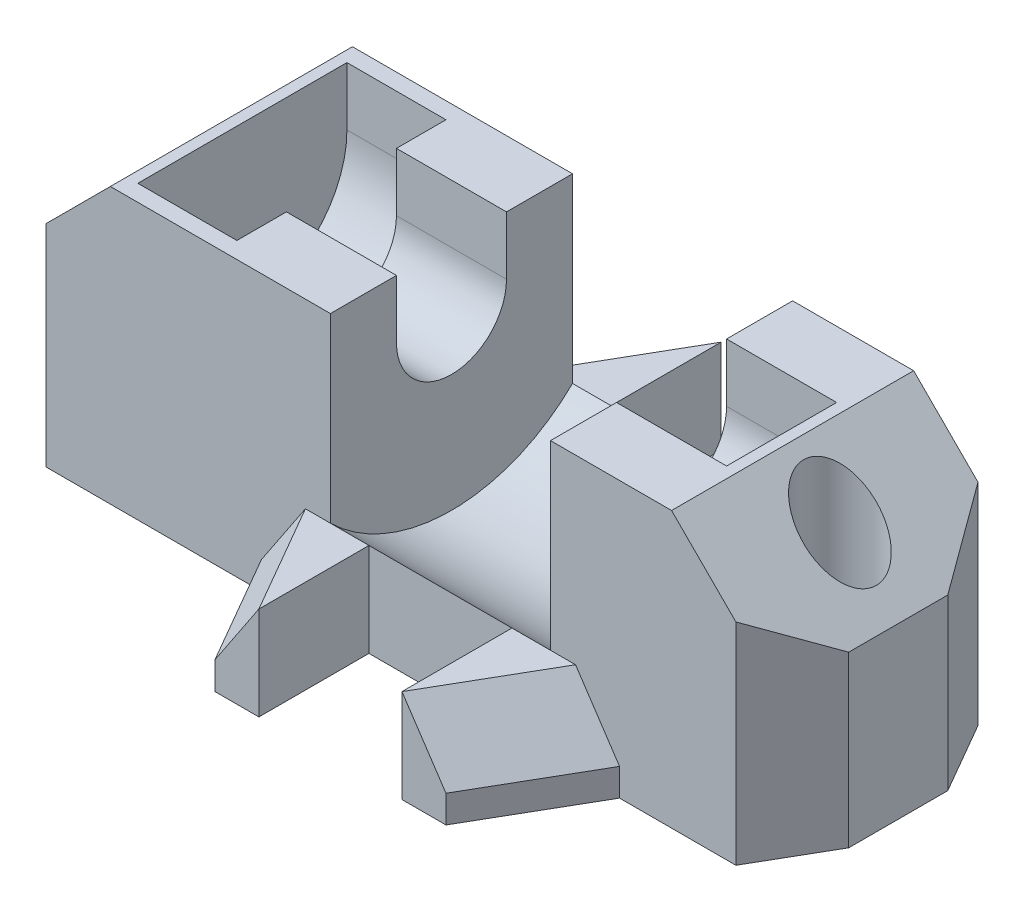
from build123d import *
from OCP.BRepFilletAPI import BRepFilletAPI_MakeChamfer

# Parameters (mm, degrees)
SKIZZE1_R                       = 1.65
AUFSATZ_LINEAR_AUSTRAGEN1_DEPTH = 12.5
SCHNITT_LINEAR_START            = -10.3
SKIZZE2_R                       = 7.85
SKIZZE2_R_2                     = 2.5
SCHNITT_LINEAR_AUSTRAGEN1_DEPTH = 10
SCHNITT_LINEAR_START_2          = -5.3
SCHNITT_LINEAR_AUSTRAGEN2_DEPTH = 20
SCHNITT_LINEAR_AUSTRAGEN3_DEPTH = 4.5
SCHNITT_LINEAR_START_3          = -11
SCHNITT_LINEAR_AUSTRAGEN4_DEPTH = 11
AUFSATZ_LINEAR_START            = -4.248884
AUFSATZ_LINEAR_AUSTRAGEN2_DEPTH = 4.248884
FASE1_SIZE                      = 3
FASE1_SIZE2                     = 1.732050808


with BuildPart() as part:
    # Skizze1 → Aufsatz-Linear austragen1 (new body)
    with BuildSketch(Plane(origin=(0, 0, 0), x_dir=(1, 0, 0), z_dir=(0, 1, 0))):
        Polygon((0, 11), (-31.34722325, 11), (-33.223611625, 7.75), (-33.223611625, 3.25), (-31.34722325, 0), (0, 0), (1.876388375, 3.25), (1.876388375, 7.75), align=None)
        with Locations(Location((-0.773611625, 5.5, 0), (0, 0, 270))):
            Circle(SKIZZE1_R, mode=Mode.SUBTRACT)
        with Locations(Location((-30.573611625, 5.5, 0), (0, 0, 270))):
            Circle(SKIZZE1_R, mode=Mode.SUBTRACT)
    extrude(amount=AUFSATZ_LINEAR_AUSTRAGEN1_DEPTH)

    # Skizze2 → Schnitt-Linear austragen1 (cut)
    with BuildSketch(Plane(origin=(1.876388375, 0, 0), x_dir=(0, 0, -1), z_dir=(1, 0, 0)).offset(SCHNITT_LINEAR_START)):
        with Locations((5.5, 9.85)):
            Circle(SKIZZE2_R)
        with Locations((5.5, 9.85)):
            Circle(SKIZZE2_R_2, mode=Mode.SUBTRACT)
    extrude(amount=-SCHNITT_LINEAR_AUSTRAGEN1_DEPTH, mode=Mode.SUBTRACT)

    # Skizze3 → Schnitt-Linear austragen2 (cut)
    with BuildSketch(Plane(origin=(1.876388375, 0, 0), x_dir=(0, 0, -1), z_dir=(1, 0, 0)).offset(SCHNITT_LINEAR_START_2)):
        with BuildLine():
            Line((7.75, 12.5), (3.25, 12.5))
            Line((3.25, 12.5), (3.25, 10.939724736))
            ThreePointArc((3.25, 10.939724736), (5.5, 12.35), (7.75, 10.939724736))
            Line((7.75, 10.939724736), (7.75, 12.5))
        make_face()
        with BuildLine():
            Line((8, 12.5), (7.75, 12.5))
            Line((7.75, 12.5), (7.75, 10.939724736))
            ThreePointArc((7.75, 10.939724736), (7.936698586, 10.409016994), (8, 9.85))
            Line((8, 9.85), (8, 12.5))
        make_face()
        with BuildLine():
            Line((3.25, 12.5), (3, 12.5))
            Line((3, 12.5), (3, 9.85))
            ThreePointArc((3, 9.85), (3.063301414, 10.409016994), (3.25, 10.939724736))
            Line((3.25, 10.939724736), (3.25, 12.5))
        make_face()
        with BuildLine():
            ThreePointArc((7.75, 10.939724736), (5.5, 12.35), (3.25, 10.939724736))
            Line((3.25, 10.939724736), (3.25, 8.760275264))
            ThreePointArc((3.25, 8.760275264), (5.5, 7.35), (7.75, 8.760275264))
            Line((7.75, 8.760275264), (7.75, 10.939724736))
        make_face()
        with BuildLine():
            ThreePointArc((3.25, 10.939724736), (3.063301414, 10.409016994), (3, 9.85))
            ThreePointArc((3, 9.85), (3.063301414, 9.290983006), (3.25, 8.760275264))
            Line((3.25, 8.760275264), (3.25, 10.939724736))
        make_face()
        with BuildLine():
            ThreePointArc((8, 9.85), (7.936698586, 10.409016994), (7.75, 10.939724736))
            Line((7.75, 10.939724736), (7.75, 8.760275264))
            ThreePointArc((7.75, 8.760275264), (7.936698586, 9.290983006), (8, 9.85))
        make_face()
    extrude(amount=-SCHNITT_LINEAR_AUSTRAGEN2_DEPTH, mode=Mode.SUBTRACT)

    # Skizze4 → Schnitt-Linear austragen3 (cut)
    with BuildSketch(Plane(origin=(-23.423611625, 0, 0), x_dir=(0, 0, -1), z_dir=(1, 0, 0))):
        with BuildLine():
            Line((10.25, 12.5), (0.75, 12.5))
            Line((0.75, 12.5), (0.75, 9.85))
            ThreePointArc((0.75, 9.85), (5.5, 5.1), (10.25, 9.85))
            Line((10.25, 9.85), (10.25, 12.5))
        make_face()
    extrude(amount=-SCHNITT_LINEAR_AUSTRAGEN3_DEPTH, mode=Mode.SUBTRACT)

    # Skizze5 → Schnitt-Linear austragen4 (cut)
    with BuildSketch(Plane.XY.offset(SCHNITT_LINEAR_START_3)):
        Polygon((1.876388375, 12.5), (-2.923611625, 12.5), (1.876388375, 7.7), align=None)
        Polygon((-33.223611625, 12.5), (-28.423611625, 12.5), (-33.223611625, 7.7), align=None)
    extrude(amount=SCHNITT_LINEAR_AUSTRAGEN4_DEPTH, mode=Mode.SUBTRACT)

    # Skizze6 → Aufsatz-Linear austragen2 (add)
    with BuildSketch(Plane.XZ.offset(AUFSATZ_LINEAR_START)):
        Polygon((-16.673611625, 0), (-16.673611625, 5), (-18.673611625, 5), (-21.560362971, 0), align=None)
        Polygon((-10.173611625, 0), (-10.173611625, 5), (-8.173611625, 5), (-5.286860279, 0), align=None)
        Polygon((-18.673611625, -16), (-21.560362971, -11), (-16.673611625, -11), (-16.673611625, -16), align=None)
        Polygon((-10.173611625, -11), (-5.286860279, -11), (-8.173611625, -16), (-10.173611625, -16), align=None)
    extrude(amount=AUFSATZ_LINEAR_AUSTRAGEN2_DEPTH)

    # Fase1: one chamfer whose edges measure the first distance from different faces: ONE call of the kernel's chamfer builder (chamfer() names one face for all edges)
    fase1_edges_1 = [part.edges().sort_by_distance(p)[0] for p in [
        (-6.730235952, 4.248884, -13.5),
    ]]
    fase1_side_1 = [part.faces().sort_by_distance(p)[0] for p in [
        (-6.730235952, 2.124442, -13.5),
    ]]
    fase1_edges_2 = [part.edges().sort_by_distance(p)[0] for p in [
        (-20.116987298, 4.248884, -13.5),
    ]]
    fase1_side_2 = [part.faces().sort_by_distance(p)[0] for p in [
        (-20.116987298, 2.124442, -13.5),
    ]]
    fase1_edges_3 = [part.edges().sort_by_distance(p)[0] for p in [
        (-6.730235952, 4.248884, 2.5),
    ]]
    fase1_side_3 = [part.faces().sort_by_distance(p)[0] for p in [
        (-6.730235952, 2.124442, 2.5),
    ]]
    fase1_edges_4 = [part.edges().sort_by_distance(p)[0] for p in [
        (-20.116987298, 4.248884, 2.5),
    ]]
    fase1_side_4 = [part.faces().sort_by_distance(p)[0] for p in [
        (-20.116987298, 2.124442, 2.5),
    ]]
    fase1 = BRepFilletAPI_MakeChamfer(part.part.solid().wrapped)
    for e in fase1_edges_1:
        fase1.Add(FASE1_SIZE, FASE1_SIZE2, e.wrapped, fase1_side_1[0].wrapped)  # the first distance lies on this face
    for e in fase1_edges_2:
        fase1.Add(FASE1_SIZE, FASE1_SIZE2, e.wrapped, fase1_side_2[0].wrapped)  # the first distance lies on this face
    for e in fase1_edges_3:
        fase1.Add(FASE1_SIZE, FASE1_SIZE2, e.wrapped, fase1_side_3[0].wrapped)  # the first distance lies on this face
    for e in fase1_edges_4:
        fase1.Add(FASE1_SIZE, FASE1_SIZE2, e.wrapped, fase1_side_4[0].wrapped)  # the first distance lies on this face
    add(Compound.cast(fase1.Shape()), mode=Mode.REPLACE)


solid = part.part
